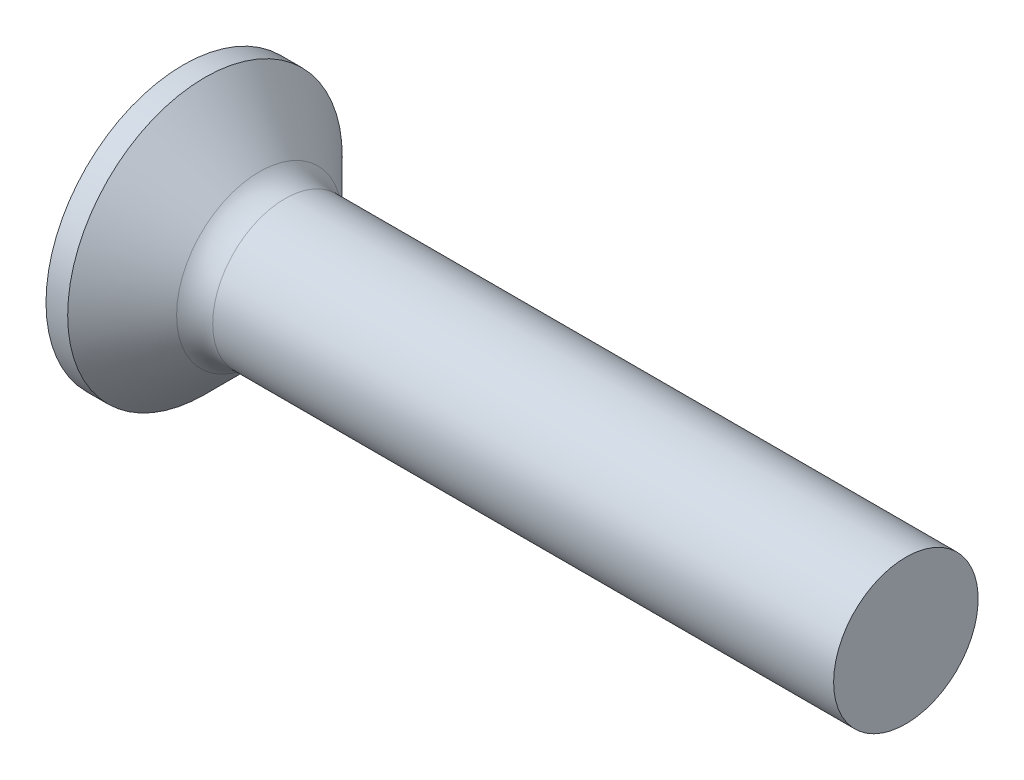
from build123d import *

# Parameters (mm, degrees)
FILLET1_R    = 0.5
RECPAT_COUNT = 2
RECPAT_ANGLE = 90


with BuildPart() as part:
    # BodySke → Base-Revolve (revolve)
    with BuildSketch(Plane.XY, mode=Mode.PRIVATE) as base_revolve_sk:
        Polygon((0, 0), (0, 1.9), (0.3, 1.9), (1.2, 1), (10, 1), (10, 0), align=None)
    revolve(base_revolve_sk.sketch.rotate(Axis((-6.35, 0, 0), (1, 0, 0)), 90), axis=Axis((-6.35, 0, 0), (1, 0, 0)))

    # Fillet1
    fillet1_edges = [part.edges().sort_by_distance(p)[0] for p in [
        (1.2, 0, -1),
    ]]
    fillet(fillet1_edges, radius=FILLET1_R)

    # Sketch3 → Recess section 0
    with BuildSketch(Plane.ZY):
        with BuildLine():
            Line((-0.24, 0.95), (0.24, 0.95))
            Line((0.24, 0.95), (0.24, -0.95))
            Line((0.24, -0.95), (-0.24, -0.95))
            Line((-0.24, -0.95), (-0.24, 0.95))
        make_face()
    # Sketch4 → Recess section 1
    with BuildSketch(Plane.ZY.offset(-1.2)):
        with BuildLine():
            Line((-0.24, 0.351702091), (0.24, 0.351702091))
            Line((0.24, 0.351702091), (0.24, -0.351702091))
            Line((0.24, -0.351702091), (-0.24, -0.351702091))
            Line((-0.24, -0.351702091), (-0.24, 0.351702091))
        make_face()
    recess = loft(mode=Mode.SUBTRACT)

    # RecPat: Recess ×2 about axis
    recpat_axis = Axis((0, 0, 0), (1, 0, 0))
    for i in range(1, RECPAT_COUNT):
        add(recess.rotate(recpat_axis, i * RECPAT_ANGLE / (RECPAT_COUNT - 1)), mode=Mode.SUBTRACT)

    # RecCorSke → RecessCore (revolve, cut)
    with BuildSketch(Plane.XY, mode=Mode.PRIVATE) as recesscore_sk:
        Polygon((0, 0), (0, 0.439412174), (1.2, 0.3555), (1.315508952, 0), align=None)
    revolve(recesscore_sk.sketch.rotate(Axis((-3.175, 0, 0), (1, 0, 0)), 90), axis=Axis((-3.175, 0, 0), (1, 0, 0)), mode=Mode.SUBTRACT)


solid = part.part
